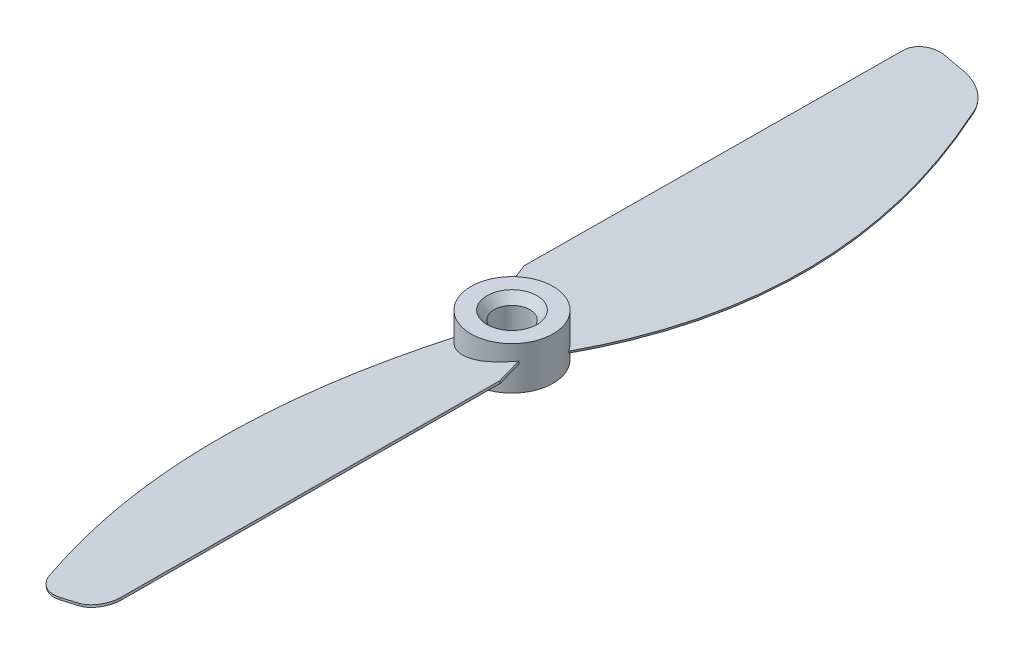
from build123d import *
from OCP.BRepFilletAPI import BRepFilletAPI_MakeChamfer

# Parameters (mm, degrees)
SKETCH1_R           = 5.75
BOSS_EXTRUDE1_DEPTH = 3
BOSS_EXTRUDE3_DEPTH = 0.3
CIRPATTERN1_COUNT   = 2
SKETCH4_R           = 2.5
CUT_EXTRUDE1_DEPTH  = 65.609278472
CHAMFER1_SIZE       = 1
CHAMFER1_SIZE2      = 1.191753593


with BuildPart() as part:
    # Sketch1 → Boss-Extrude1 (new, symmetric)
    with BuildSketch(Plane(origin=(0, 0, 0), x_dir=(1, 0, 0), z_dir=(0, 1, 0))):
        with Locations(Location((0, 0, 0), (0, 0, 270))):
            Circle(SKETCH1_R)
    extrude(amount=BOSS_EXTRUDE1_DEPTH, both=True)

    # Sketch3 → Boss-Extrude3 (add)
    with BuildSketch(Plane(origin=(0, 0, 0), x_dir=(0.9743700647852351, -0.22495105434386534, 0), z_dir=(-0.22495105434386534, -0.9743700647852351, 0))):
        with BuildLine():
            Line((-4.869810272, -3.811414063), (-6.277481036, -7.811414063))
            Line((-6.277481036, -7.811414063), (-5.9307932, -60.519732009))
            ThreePointArc((-5.9307932, -60.519732009), (-5.045190608, -62.628285228), (-2.930858092, -63.5))
            Line((-2.930858092, -63.5), (-0.266005483, -63.5))
            ThreePointArc((-0.266005483, -63.5), (2.708645134, -62.518887124), (4.515908541, -59.960581485))
            add(Edge.make_bspline(
                [(4.515908541, -59.960581485), (16.627834102, -30.503690424), (4.515908541, -2.064662287)],
                knots=[0, 0, 0, 1, 1, 1], degree=2))
            add(Edge.make_bspline(
                [(-4.869810272, -3.811414063), (0.634471784, -8.039563779), (4.515908541, -2.064662287)],
                knots=[0, 0, 0, 1, 1, 1], degree=2))
        make_face()
    boss_extrude3 = extrude(amount=BOSS_EXTRUDE3_DEPTH)

    # CirPattern1: Boss-Extrude3 ×2 about axis
    cirpattern1_axis = Axis((0, 3, 0), (0, -1, 0))
    for i in range(1, CIRPATTERN1_COUNT):
        add(boss_extrude3.rotate(cirpattern1_axis, i * 360 / CIRPATTERN1_COUNT))

    # Sketch4 → Cut-Extrude1 (cut, through all)
    with BuildSketch(Plane(origin=(0, 3, 0), x_dir=(1, 0, 0), z_dir=(0, 1, 0))):
        with Locations(Location((0, 0, 0), (0, 0, 270))):
            Circle(SKETCH4_R)
    extrude(amount=-CUT_EXTRUDE1_DEPTH, mode=Mode.SUBTRACT)

    # Chamfer1: one chamfer whose edges measure the first distance from different faces: ONE call of the kernel's chamfer builder (chamfer() names one face for all edges)
    chamfer1_edges_1 = [part.edges().sort_by_distance(p)[0] for p in [
        (0, -3, -2.5),
    ]]
    chamfer1_side_1 = [part.faces().sort_by_distance(p)[0] for p in [
        (0, 0, -2.5),
    ]]
    chamfer1_edges_2 = [part.edges().sort_by_distance(p)[0] for p in [
        (0, 3, -2.5),
    ]]
    chamfer1_side_2 = [part.faces().sort_by_distance(p)[0] for p in [
        (0, 3, -5.58736544),
    ]]
    chamfer1 = BRepFilletAPI_MakeChamfer(part.part.solid().wrapped)
    for e in chamfer1_edges_1:
        chamfer1.Add(CHAMFER1_SIZE, CHAMFER1_SIZE2, e.wrapped, chamfer1_side_1[0].wrapped)  # the first distance lies on this face
    for e in chamfer1_edges_2:
        chamfer1.Add(CHAMFER1_SIZE, CHAMFER1_SIZE2, e.wrapped, chamfer1_side_2[0].wrapped)  # the first distance lies on this face
    add(Compound.cast(chamfer1.Shape()), mode=Mode.REPLACE)


solid = part.part
